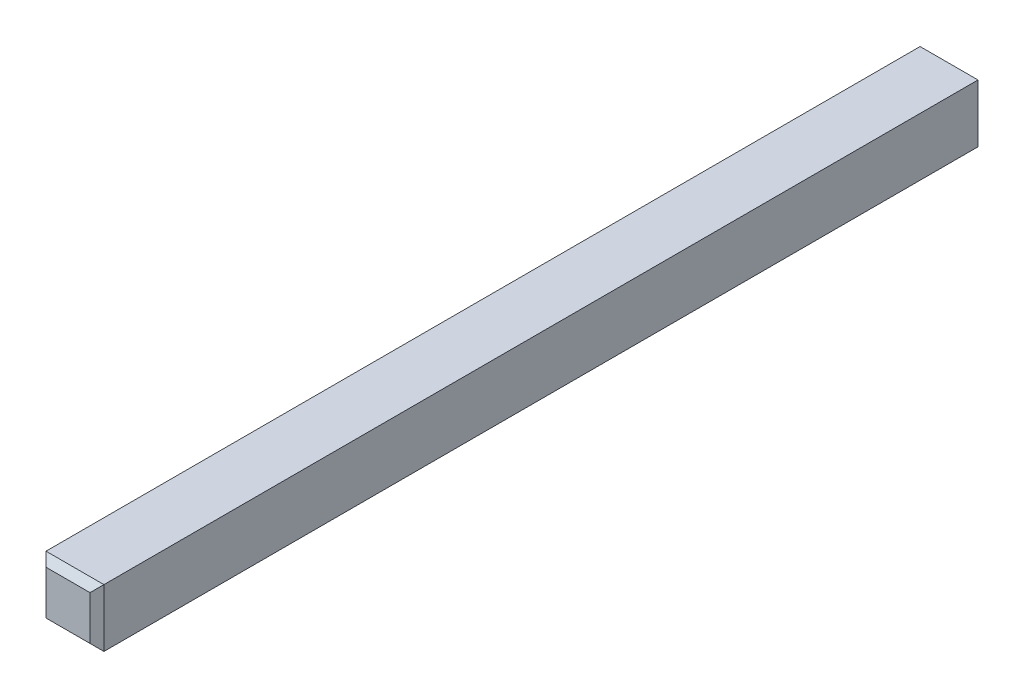
from build123d import *

# Parameters (mm, degrees)
SKETCH1_W           = 0.75
SKETCH1_H           = 0.75
BOSS_EXTRUDE1_DEPTH = 11.5
CHAMFER1_SIZE       = 0.09


with BuildPart() as part:
    # Sketch1 → Boss-Extrude1 (new body)
    with BuildSketch(Plane.XY):
        with Locations((0.375, 0.375)):
            Rectangle(SKETCH1_W, SKETCH1_H)
    extrude(amount=BOSS_EXTRUDE1_DEPTH)

    # Chamfer1
    chamfer1_edges = [part.edges().sort_by_distance(p)[0] for p in [
        (0.75, 0.375, 11.5),
        (0.375, 0.75, 11.5),
        (0, 0.375, 11.5),
        (0.375, 0.75, 0),
        (0.75, 0.375, 0),
        (0.375, 0, 0),
        (0, 0.375, 0),
        (0.375, 0, 11.5),
    ]]
    chamfer(chamfer1_edges, length=CHAMFER1_SIZE)


solid = part.part
